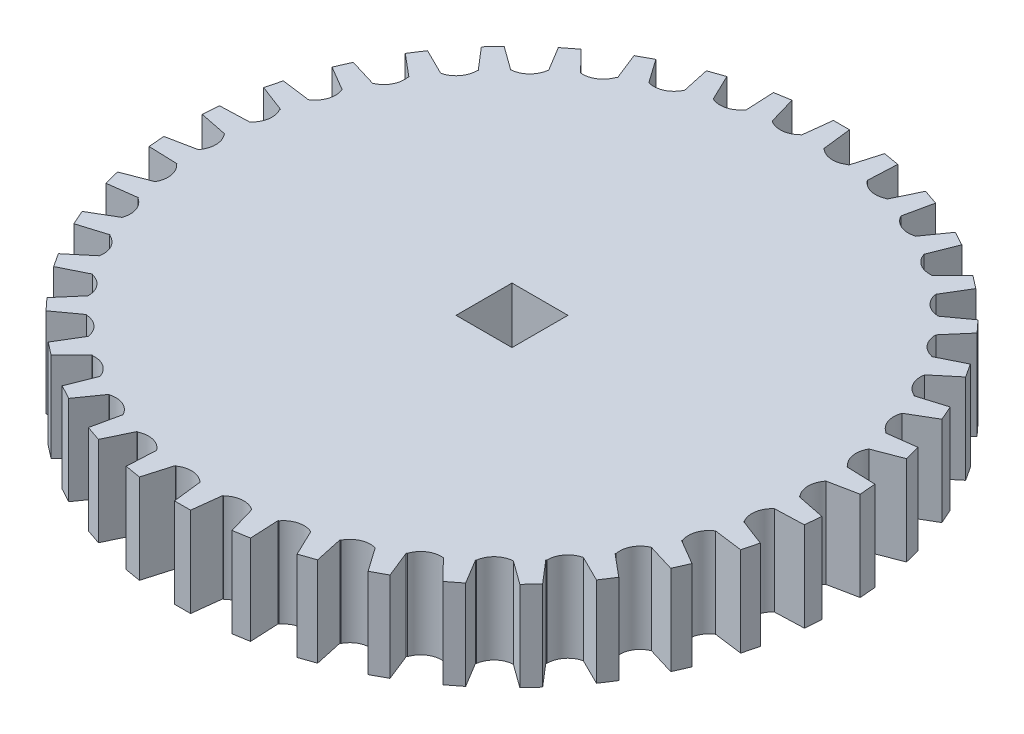
from build123d import *

# Parameters (mm, degrees)
SKETCH1_R           = 21.336
BOSS_EXTRUDE1_DEPTH = 6.35
BOSS_EXTRUDE2_START = -6.35
BOSS_EXTRUDE2_DEPTH = 6.35
CUT_EXTRUDE1_DEPTH  = 33.273996034
CIRPATTERN1_COUNT   = 38
SKETCH3_W           = 3.96759605
SKETCH3_H           = 3.96759605
CUT_EXTRUDE2_DEPTH  = 34.629241865


with BuildPart() as part:
    # Sketch1 → Boss-Extrude1 (new body)
    with BuildSketch(Plane(origin=(0, 0, 0), x_dir=(1, 0, 0), z_dir=(0, 1, 0))):
        with Locations(Location((0, 0, 0), (0, 0, 270))):
            Circle(SKETCH1_R)
    extrude(amount=BOSS_EXTRUDE1_DEPTH)

    # Sketch2 → Boss-Extrude2 (add)
    with BuildSketch(Plane(origin=(0, 6.35, 0), x_dir=(1, 0, 0), z_dir=(0, 1, 0)).offset(BOSS_EXTRUDE2_START)):
        with BuildLine():
            Line((0.5715, 23.368), (-0.5715, 23.368))
            Line((-0.5715, 23.368), (-0.812927209, 21.320507624))
            ThreePointArc((-0.812927209, 21.320507624), (0, 21.336), (0.812927209, 21.320507624))
            Line((0.812927209, 21.320507624), (0.5715, 23.368))
        make_face()
    boss_extrude2 = extrude(amount=BOSS_EXTRUDE2_DEPTH)

    # Sketch2<4> → Cut-Extrude1 (cut, through all)
    with BuildSketch(Plane(origin=(0, 6.35, 0), x_dir=(1, 0, 0), z_dir=(0, 1, 0))):
        with BuildLine():
            ThreePointArc((0.812927209, 21.320507624), (1.735304589, 21.265314799), (2.654427209, 21.17023647))
            ThreePointArc((2.654427209, 21.17023647), (1.706708672, 20.914885726), (0.812927209, 21.320507624))
        make_face()
    cut_extrude1 = extrude(amount=-CUT_EXTRUDE1_DEPTH, mode=Mode.SUBTRACT)

    # CirPattern1: Boss-Extrude2, Cut-Extrude1 ×38 about axis
    cirpattern1_axis = Axis((0, 0, 0), (0, 1, 0))
    add([boss_extrude2.rotate(cirpattern1_axis, i * 360 / CIRPATTERN1_COUNT) for i in range(1, CIRPATTERN1_COUNT)])
    add([cut_extrude1.rotate(cirpattern1_axis, i * 360 / CIRPATTERN1_COUNT) for i in range(1, CIRPATTERN1_COUNT)], mode=Mode.SUBTRACT)

    # Sketch3 → Cut-Extrude2 (cut, through all)
    with BuildSketch(Plane(origin=(0, 6.35, 0), x_dir=(1, 0, 0), z_dir=(0, 1, 0))):
        Rectangle(SKETCH3_W, SKETCH3_H)
    extrude(amount=-CUT_EXTRUDE2_DEPTH, mode=Mode.SUBTRACT)


solid = part.part
